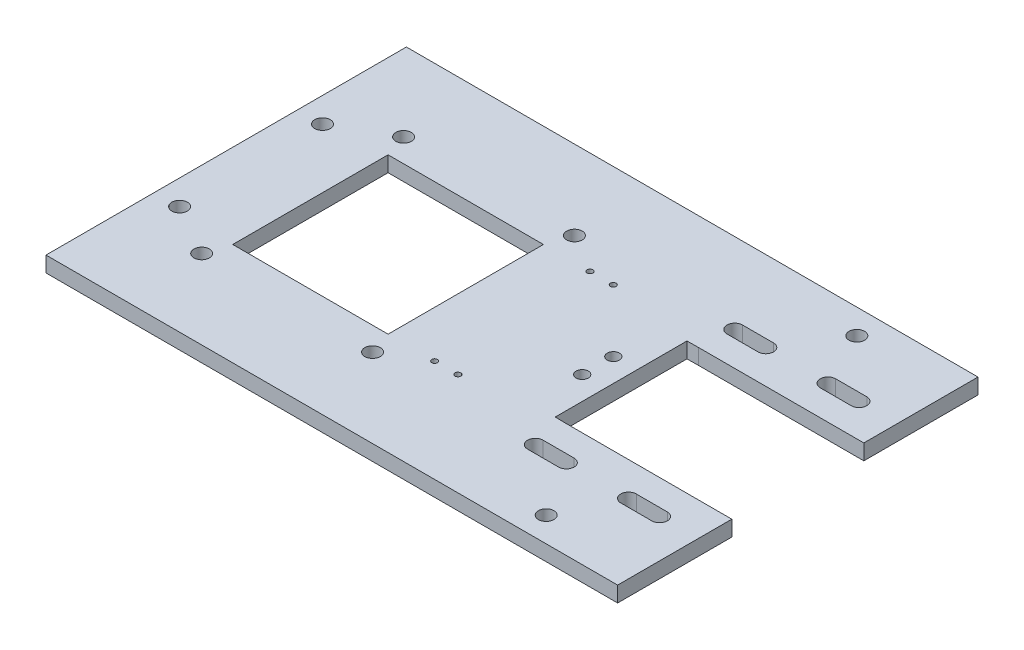
from build123d import *

# Parameters (mm, degrees)
SKETCH1_R           = 1.175004
SKETCH1_R_2         = 2.4892
SKETCH1_R_3         = 3.175
SKETCH1_W           = 63.5
SKETCH1_H           = 63.5
BOSS_EXTRUDE1_DEPTH = 6.35
SKETCH3_R           = 3.175
CUT_EXTRUDE1_DEPTH  = 6.35


with BuildPart() as part:
    # Sketch1 → Boss-Extrude1 (new body)
    with BuildSketch(Plane(origin=(0, 0, 0), x_dir=(1, 0, 0), z_dir=(0, 1, 0))):
        Polygon((-107.95, -73.66), (107.95, -73.66), (107.95, -26.9875), (40.462499974, -26.9875), (35.699999974, -26.924), (35.699999974, 26.924), (40.462499974, 26.9875), (107.95, 26.9875), (107.95, 73.66), (-107.95, 73.66), (-125.73, 73.66), (-125.73, -73.66), align=None)
        with Locations(Location((0.750006374, -31.75, 0), (0, 0, 270))):
            Circle(SKETCH1_R, mode=Mode.SUBTRACT)
        with Locations(Location((26.174999974, 6.35, 0), (0, 0, 270))):
            Circle(SKETCH1_R_2, mode=Mode.SUBTRACT)
        with Locations(Location((26.174999974, -6.35, 0), (0, 0, 90))):
            Circle(SKETCH1_R_2, mode=Mode.SUBTRACT)
        with Locations(Location((-8.750000026, -31.75, 0), (0, 0, 270))):
            Circle(SKETCH1_R, mode=Mode.SUBTRACT)
        with Locations(Location((-94.475000026, -41.275, 0), (0, 0, 90))):
            Circle(SKETCH1_R_3, mode=Mode.SUBTRACT)
        with Locations(Location((-24.625000026, -41.275, 0), (0, 0, 90))):
            Circle(SKETCH1_R_3, mode=Mode.SUBTRACT)
        with Locations(Location((-8.750000026, 31.75, 0), (0, 0, 90))):
            Circle(SKETCH1_R, mode=Mode.SUBTRACT)
        with Locations(Location((-94.475000026, 41.275, 0), (0, 0, 270))):
            Circle(SKETCH1_R_3, mode=Mode.SUBTRACT)
        with Locations(Location((-24.625000026, 41.275, 0), (0, 0, 270))):
            Circle(SKETCH1_R_3, mode=Mode.SUBTRACT)
        with Locations(Location((0.750006374, 31.75, 0), (0, 0, 90))):
            Circle(SKETCH1_R, mode=Mode.SUBTRACT)
        with BuildLine():
            Line((79.502, 37.592), (92.202, 37.592))
            ThreePointArc((92.202, 37.592), (95.377, 40.767), (92.202, 43.942))
            Line((92.202, 43.942), (79.502, 43.942))
            ThreePointArc((79.502, 43.942), (76.327, 40.767), (79.502, 37.592))
        make_face(mode=Mode.SUBTRACT)
        with BuildLine():
            Line((41.402, 37.592), (54.102, 37.592))
            ThreePointArc((54.102, 37.592), (57.277, 40.767), (54.102, 43.942))
            Line((54.102, 43.942), (41.402, 43.942))
            ThreePointArc((41.402, 43.942), (38.227, 40.767), (41.402, 37.592))
        make_face(mode=Mode.SUBTRACT)
        with BuildLine():
            Line((79.502, -43.942), (92.202, -43.942))
            ThreePointArc((92.202, -43.942), (95.377, -40.767), (92.202, -37.592))
            Line((92.202, -37.592), (79.502, -37.592))
            ThreePointArc((79.502, -37.592), (76.327, -40.767), (79.502, -43.942))
        make_face(mode=Mode.SUBTRACT)
        with BuildLine():
            Line((41.402, -37.592), (54.102, -37.592))
            ThreePointArc((54.102, -37.592), (57.277, -40.767), (54.102, -43.942))
            Line((54.102, -43.942), (41.402, -43.942))
            ThreePointArc((41.402, -43.942), (38.227, -40.767), (41.402, -37.592))
        make_face(mode=Mode.SUBTRACT)
        with Locations((-59.550000026, 0)):
            Rectangle(SKETCH1_W, SKETCH1_H, mode=Mode.SUBTRACT)
    extrude(amount=BOSS_EXTRUDE1_DEPTH)

    # Sketch3 → Cut-Extrude1 (cut)
    with BuildSketch(Plane(origin=(0, 6.35, 0), x_dir=(1, 0, 0), z_dir=(0, 1, 0))):
        with Locations(Location((-115.57, 29.21, 0), (0, 0, 270))):
            Circle(SKETCH3_R)
        with Locations(Location((-115.57, -29.21, 0), (0, 0, 270))):
            Circle(SKETCH3_R)
        with Locations(Location((68.58, 63.5, 0), (0, 0, 270))):
            Circle(SKETCH3_R)
        with Locations(Location((68.58, -63.5, 0), (0, 0, 270))):
            Circle(SKETCH3_R)
    extrude(amount=-CUT_EXTRUDE1_DEPTH, mode=Mode.SUBTRACT)


solid = part.part
